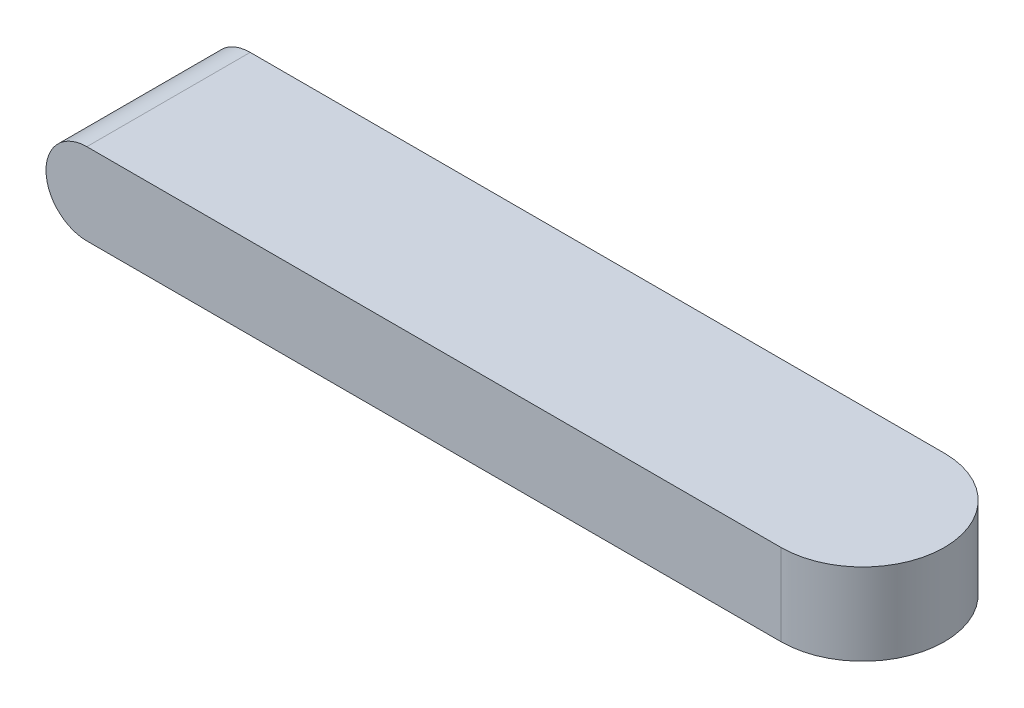
from build123d import *

# Parameters (mm, degrees)
SKETCH1_W           = 10
SKETCH1_H           = 1
BOSS_EXTRUDE1_DEPTH = 2
FILLET1_RADIUS      = 1
FILLET1_LENGTH      = 1
FILLET2_RADIUS      = 0.5
FILLET2_LENGTH      = 2


with BuildPart() as part:
    # Sketch1 → Boss-Extrude1 (new body)
    with BuildSketch(Plane.XY):
        with Locations((0.174129353, -0.226368159)):
            Rectangle(SKETCH1_W, SKETCH1_H)
    extrude(amount=BOSS_EXTRUDE1_DEPTH)

    # Fillet1: full round fillet: the end face becomes a half cylinder, R = half its width
    fillet1_face = Plane((5.174129353, -0.226368159, 1), x_dir=(0, -1, 0), z_dir=(1, 0, 0))  # on the end face: x along it, z out of the body
    fillet1_slab = fillet1_face.offset(-FILLET1_RADIUS / 2) * Box(FILLET1_LENGTH, 2 * FILLET1_RADIUS, FILLET1_RADIUS, mode=Mode.PRIVATE)  # the body's end, R deep
    fillet1_round = Plane((4.174129353, -0.226368159, 1), x_dir=(1, 0, 0), z_dir=(0, -1, 0)) * Cylinder(FILLET1_RADIUS, FILLET1_LENGTH, mode=Mode.PRIVATE)  # its axis R under the face
    add(fillet1_slab - fillet1_round, mode=Mode.SUBTRACT)

    # Fillet2: full round fillet: the end face becomes a half cylinder, R = half its width
    fillet2_face = Plane((-4.825870647, -0.226368159, 1), x_dir=(0, 0, -1), z_dir=(-1, 0, 0))  # on the end face: x along it, z out of the body
    fillet2_slab = fillet2_face.offset(-FILLET2_RADIUS / 2) * Box(FILLET2_LENGTH, 2 * FILLET2_RADIUS, FILLET2_RADIUS, mode=Mode.PRIVATE)  # the body's end, R deep
    fillet2_round = Plane((-4.325870647, -0.226368159, 1), x_dir=(-1, 0, 0), z_dir=(0, 0, -1)) * Cylinder(FILLET2_RADIUS, FILLET2_LENGTH, mode=Mode.PRIVATE)  # its axis R under the face
    add(fillet2_slab - fillet2_round, mode=Mode.SUBTRACT)


solid = part.part
